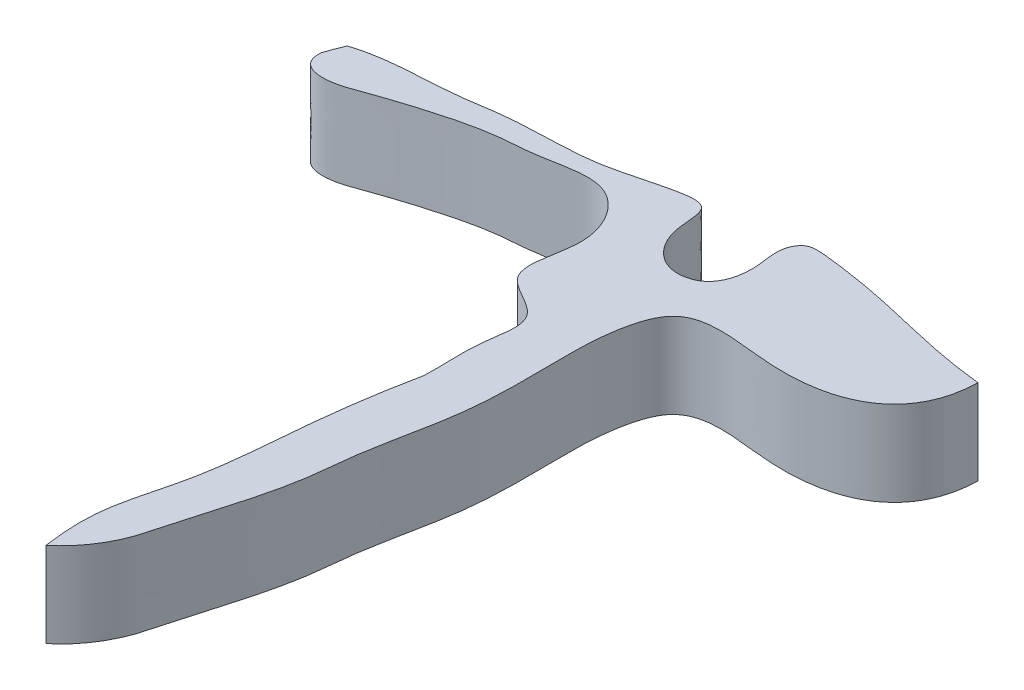
from build123d import *

# Parameters (mm, degrees)
BOSS_EXTRUDE1_DEPTH = 15


with BuildPart() as part:
    # Sketch1 → Boss-Extrude1 (new body)
    with BuildSketch(Plane(origin=(0, 0, 0), x_dir=(1, 0, 0), z_dir=(0, 1, 0))):
        with BuildLine():
            add(Edge.make_bspline(
                [(47.420375472, 177.719365279), (47.923391865, 179.308830016), (48.685902451, 181.030331376)],
                knots=[0.968241419, 0.968241419, 0.968241419, 1, 1, 1], degree=2))
            add(Edge.make_bspline(
                [(47.420375472, 177.719365279), (47.145041997, 174.571270337), (51.808266467, 173.360392084), (58.516800003, 175.988264579), (66.529402506, 178.560886227), (74.675889393, 180.59161246), (83.638862203, 180.930288074), (93.902439439, 184.369053507), (101.590112285, 172.298935737), (95.358769398, 160.020471882), (107.883313291, 156.83605583), (105.171638753, 146.495919028), (105.945825946, 141.078138074), (105.757273733, 137.419894275)],
                knots=[0.001604008, 0.001604008, 0.001604008, 0.001604008, 0.068049885, 0.126734755, 0.221277447, 0.325872867, 0.379657996, 0.499723597, 0.610693351, 0.730784057, 0.814836596, 0.893690288, 1, 1, 1, 1], degree=3))
            add(Edge.make_bspline(
                [(98.371173911, 78.231708436), (97.919327158, 81.436571947), (97.382407557, 89.07479991), (101.802241125, 102.143245912), (102.790355639, 119.297508142), (104.336005259, 130.446896526), (105.753591562, 137.401839946), (105.757273733, 137.419894275)],
                knots=[0.632065867, 0.632065867, 0.632065867, 0.632065867, 0.653634391, 0.683152646, 0.723780599, 0.766209008, 0.766319387, 0.766319387, 0.766319387, 0.766319387], degree=3))
            add(Edge.make_bspline(
                [(155.713820159, 185.222032492), (155.425874835, 173.100712353), (140.483266869, 166.904105138), (118.936964383, 172.612470356), (115.192644125, 160.330308288), (115.3482681, 149.617652952), (115.444629092, 134.450964327), (112.045371199, 122.272000915), (110.825170091, 106.919954458), (107.256011137, 97.098479499), (104.28720935, 85.057124746), (101.326801423, 80.620711931), (98.371173911, 78.231708436)],
                knots=[0, 0, 0, 0, 0.208504743, 0.326502314, 0.372956542, 0.455666883, 0.565002653, 0.694719851, 0.729433596, 0.891839378, 0.917522653, 1, 1, 1, 1], degree=3))
            add(Edge.make_bspline(
                [(155.713820159, 185.222032492), (143.342435393, 186.514221571), (135.762881067, 190.123760484), (119.677410663, 191.492652461), (117.384240858, 188.11808891), (119.102072841, 183.057235227), (117.46906076, 176.157823141), (109.760824826, 174.578358032), (104.924855368, 180.553269249), (105.843805349, 189.040101481), (96.531834295, 187.28959605), (86.983269228, 184.161983925), (76.605916719, 184.931536336), (62.096707277, 182.363322148), (54.527898303, 182.998481509), (48.685902451, 181.030331376)],
                knots=[0, 0, 0, 0, 0.237104515, 0.256899287, 0.271012147, 0.314512839, 0.364494543, 0.396714068, 0.458476347, 0.498896481, 0.536121657, 0.61343516, 0.730760524, 0.758905069, 0.894880611, 0.894880611, 0.894880611, 0.894880611], degree=3))
        make_face()
    extrude(amount=BOSS_EXTRUDE1_DEPTH)


solid = part.part
